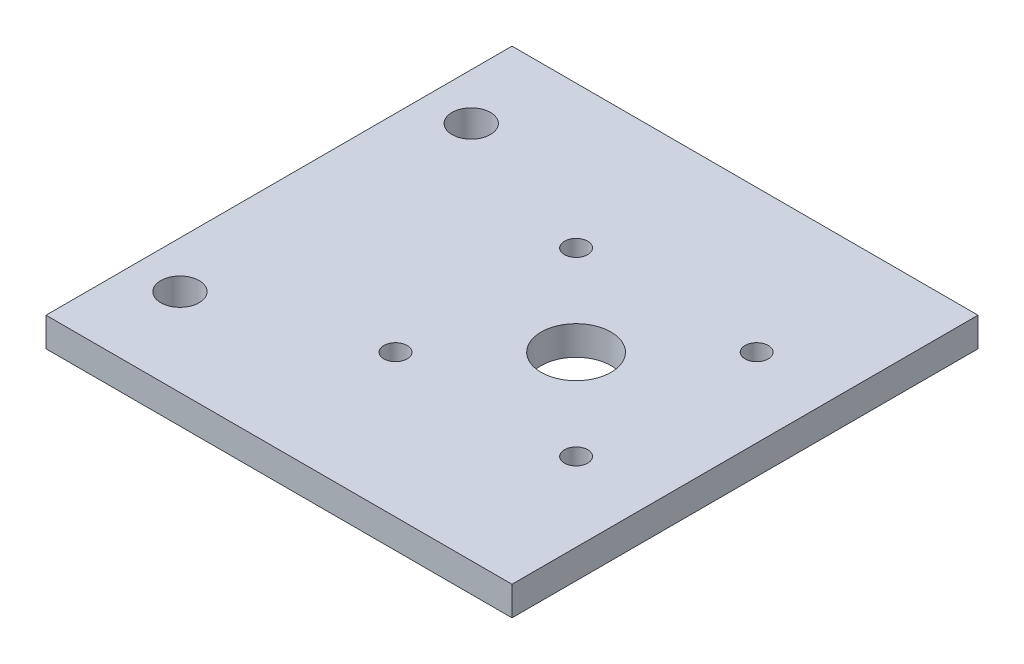
from build123d import *

# Parameters (mm, degrees)
SCHIZZO1_W                   = 80
SCHIZZO1_H                   = 5
ESTRUSIONE_ESTRUSIONE1_DEPTH = 80
FORO_PER_VITE_M6_1_D         = 6.6
SCHIZZO4_R                   = 6
TAGLIO_ESTRUSIONE1_DEPTH     = 114.247516529
SCHIZZO6_R                   = 2
TAGLIO_ESTRUSIONE3_DEPTH     = 114.247516529


with BuildPart() as part:
    # Schizzo1 → Estrusione-Estrusione1 (new body)
    with BuildSketch(Plane.XY):
        with Locations((40, 2.5)):
            Rectangle(SCHIZZO1_W, SCHIZZO1_H)
    extrude(amount=ESTRUSIONE_ESTRUSIONE1_DEPTH)

    # Foro per Vite M6-1 (through all)
    with Locations(Plane(origin=(0, 5, 0), x_dir=(1, 0, 0), z_dir=(0, 1, 0))):
        with Locations((8, -15), (8, -65)):
            Hole(FORO_PER_VITE_M6_1_D / 2)

    # Schizzo4 → Taglio-Estrusione1 (cut, through all)
    with BuildSketch(Plane(origin=(0, 5, 0), x_dir=(1, 0, 0), z_dir=(0, 1, 0))):
        with Locations(Location((51, -40, 0), (0, 0, 270))):
            Circle(SCHIZZO4_R)
    extrude(amount=-TAGLIO_ESTRUSIONE1_DEPTH, mode=Mode.SUBTRACT)

    # Schizzo6 → Taglio-Estrusione3 (cut, through all)
    with BuildSketch(Plane(origin=(0, 5, 0), x_dir=(1, 0, 0), z_dir=(0, 1, 0))):
        with Locations(Location((35.5, -24.5, 0), (0, 0, 270))):
            Circle(SCHIZZO6_R)
        with Locations(Location((66.5, -24.5, 0), (0, 0, 270))):
            Circle(SCHIZZO6_R)
        with Locations(Location((66.5, -55.5, 0), (0, 0, 270))):
            Circle(SCHIZZO6_R)
        with Locations(Location((35.5, -55.5, 0), (0, 0, 270))):
            Circle(SCHIZZO6_R)
    extrude(amount=-TAGLIO_ESTRUSIONE3_DEPTH, mode=Mode.SUBTRACT)


solid = part.part
